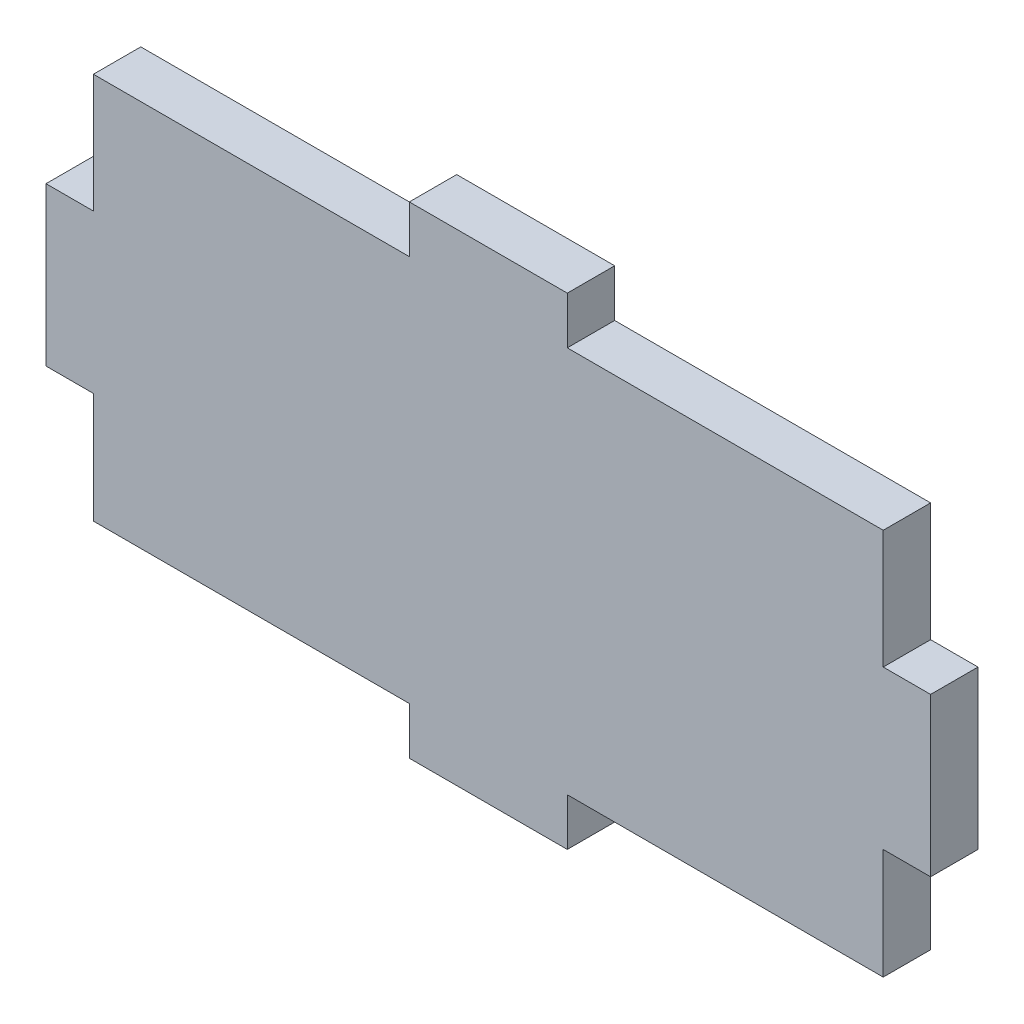
from build123d import *

# Parameters (mm, degrees)
BOSS_EXTRUDE1_DEPTH = 3


with BuildPart() as part:
    # Sketch1 → Boss-Extrude1 (new body)
    with BuildSketch(Plane(origin=(0, 0, 0), x_dir=(-1, 0, 0), z_dir=(0, 0, 1))):
        Polygon((-3.476318152, -8.337615564), (-3.476318152, -5.337615564), (6.523681848, -5.337615564), (6.523681848, -8.337615564), (26.523681848, -8.337615564), (26.523681848, -15.337615564), (29.523681848, -15.337615564), (29.523681848, -25.337615564), (26.523681848, -25.337615564), (26.523681848, -32.837615564), (6.523681848, -32.837615564), (6.523681848, -35.837615564), (-3.476318152, -35.837615564), (-3.476318152, -32.837615564), (-23.476318152, -32.837615564), (-23.476318152, -25.337615564), (-26.476318152, -25.337615564), (-26.476318152, -15.337615564), (-23.476318152, -15.337615564), (-23.476318152, -8.337615564), align=None)
    extrude(amount=BOSS_EXTRUDE1_DEPTH)


solid = part.part
